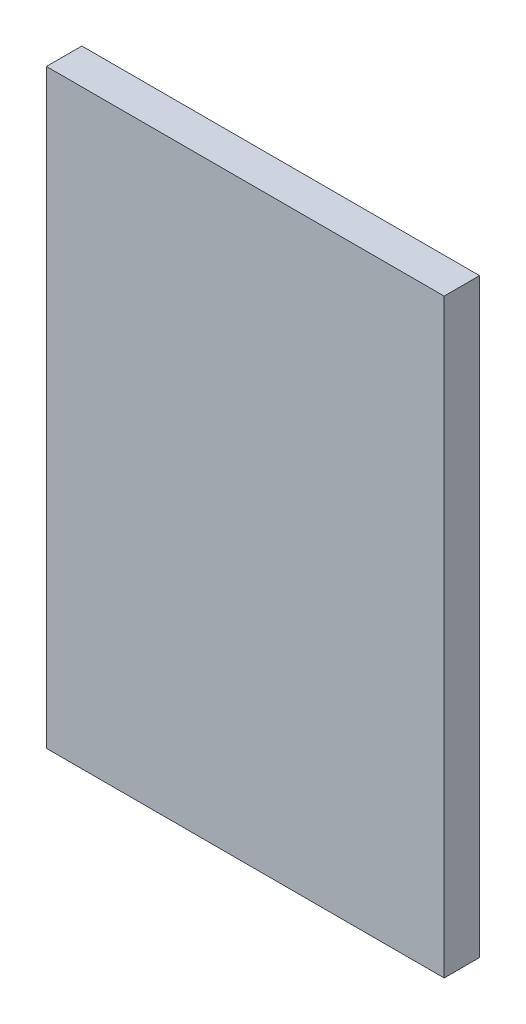
from build123d import *

# Parameters (mm, degrees)
SKETCH1_W           = 199.644
SKETCH1_H           = 296.418
BOSS_EXTRUDE1_DEPTH = 17.78


with BuildPart() as part:
    # Sketch1 → Boss-Extrude1 (new body)
    with BuildSketch(Plane.XY):
        Rectangle(SKETCH1_W, SKETCH1_H)
    extrude(amount=BOSS_EXTRUDE1_DEPTH)


solid = part.part
